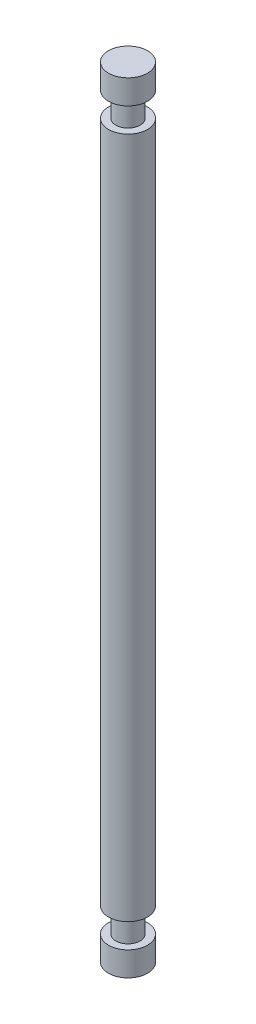
from build123d import *

# Parameters (mm, degrees)
SKETCH1_R           = 0.8
BOSS_EXTRUDE1_DEPTH = 30
SKETCH3_R           = 0.5
BOSS_EXTRUDE2_DEPTH = 1
SKETCH4_R           = 0.8
SKETCH4_R_2         = 0.5
CUT_EXTRUDE1_DEPTH  = 1
BOSS_EXTRUDE3_START = 1
SKETCH5_R           = 0.8
BOSS_EXTRUDE3_DEPTH = 1


with BuildPart() as part:
    # Sketch1 → Boss-Extrude1 (new body)
    with BuildSketch(Plane(origin=(0, 0, 0), x_dir=(1, 0, 0), z_dir=(0, 1, 0))):
        with Locations(Location((0, 0, 0), (0, 0, 270))):
            Circle(SKETCH1_R)
    extrude(amount=BOSS_EXTRUDE1_DEPTH)

    # Sketch3 → Boss-Extrude2 (add)
    with BuildSketch(Plane.XZ):
        with Locations(Location((0, 0, 0), (0, 0, 90))):
            Circle(SKETCH3_R)
    extrude(amount=BOSS_EXTRUDE2_DEPTH)

    # Sketch4 → Cut-Extrude1 (cut)
    with BuildSketch(Plane(origin=(0, 29, 0), x_dir=(1, 0, 0), z_dir=(0, 1, 0))):
        with Locations(Location((0, 0, 0), (0, 0, 270))):
            Circle(SKETCH4_R)
        with Locations(Location((0, 0, 0), (0, 0, 270))):
            Circle(SKETCH4_R_2, mode=Mode.SUBTRACT)
    extrude(amount=-CUT_EXTRUDE1_DEPTH, mode=Mode.SUBTRACT)

    # Sketch5 → Boss-Extrude3 (add)
    with BuildSketch(Plane.XZ.offset(1).offset(BOSS_EXTRUDE3_START)):
        with Locations(Location((0, 0, 0), (0, 0, 90))):
            Circle(SKETCH5_R)
    extrude(amount=-BOSS_EXTRUDE3_DEPTH)


solid = part.part
